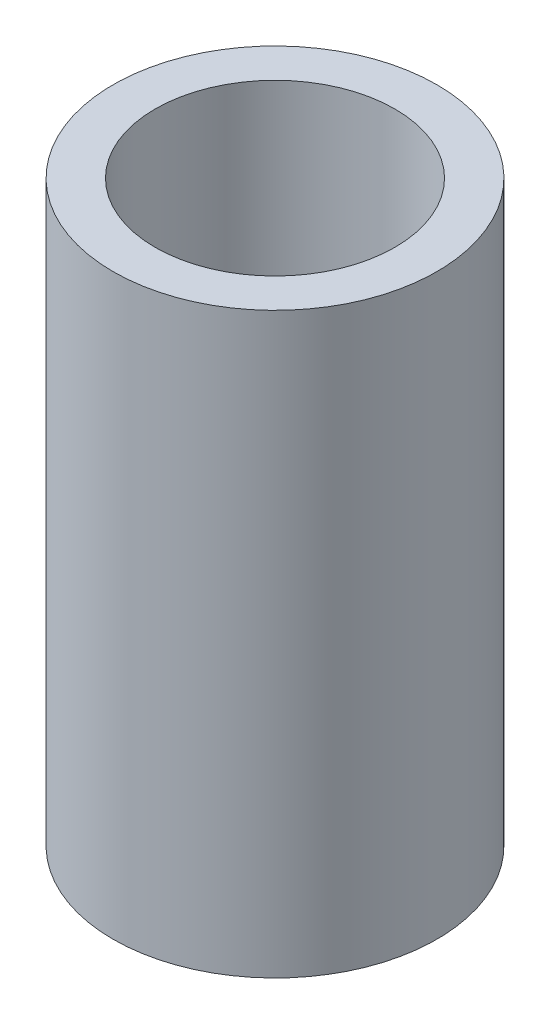
from build123d import *

# Parameters (mm, degrees)
SKETCH1_R           = 10.668
SKETCH1_R_2         = 7.8994
BOSS_EXTRUDE1_DEPTH = 38.1


with BuildPart() as part:
    # Sketch1 → Boss-Extrude1 (new body)
    with BuildSketch(Plane(origin=(0, 0, 0), x_dir=(1, 0, 0), z_dir=(0, 1, 0))):
        with Locations(Location((0, 0, 0), (0, 0, 90))):
            Circle(SKETCH1_R)
        with Locations(Location((0, 0, 0), (0, 0, 90))):
            Circle(SKETCH1_R_2, mode=Mode.SUBTRACT)
    extrude(amount=BOSS_EXTRUDE1_DEPTH)


solid = part.part
